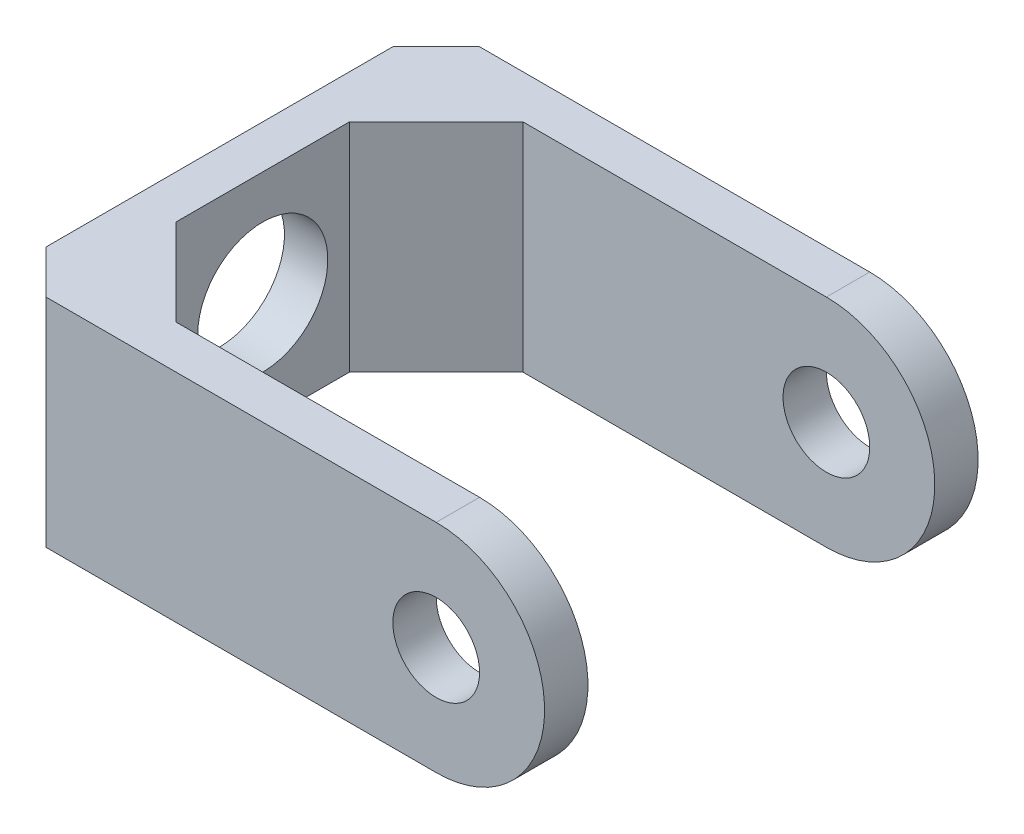
from build123d import *

# Parameters (mm, degrees)
SKETCH_1_R          = 2
EXTRUDE_1_DEPTH     = 2
SKETCH_6_W          = 20
SKETCH_6_H          = 10
EXTRUDE_5_DEPTH     = 2
CHAMFER_2_SIZE      = 2
CHAMFER_3_SIZE      = 4
SKETCH_7_R          = 3
CUT_EXTRUDE_2_DEPTH = 34.541019662


with BuildPart() as part:
    # 草图1 → 凸台-拉伸1 (new body)
    with BuildSketch(Plane.XY):
        with BuildLine():
            Line((0, 0), (18, 0))
            ThreePointArc((18, 0), (23, 5), (18, 10))
            Line((18, 10), (0, 10))
            Line((0, 10), (0, 0))
        make_face()
        with Locations((18, 5)):
            Circle(SKETCH_1_R, mode=Mode.SUBTRACT)
    extrude(amount=EXTRUDE_1_DEPTH)


with BuildPart() as body_2:
    # 镜向1: mirrored copy
    add(part.part.mirror(Plane.XY.offset(10)))


with BuildPart() as part_1:
    add(part.part)

    add(body_2.part)  # 凸台-拉伸5 merges body 2
    # 草图6 → 凸台-拉伸5 (add)
    with BuildSketch(Plane.ZY):
        with Locations((10, 5)):
            Rectangle(SKETCH_6_W, SKETCH_6_H)
    extrude(amount=EXTRUDE_5_DEPTH)

    # 倒角2
    chamfer_2_edges = [part_1.edges().sort_by_distance(p)[0] for p in [
        (-2, 5, 0),
        (-2, 5, 20),
    ]]
    chamfer(chamfer_2_edges, length=CHAMFER_2_SIZE)

    # 倒角3
    chamfer_3_edges = [part_1.edges().sort_by_distance(p)[0] for p in [
        (0, 5, 18),
        (0, 5, 2),
    ]]
    chamfer(chamfer_3_edges, length=CHAMFER_3_SIZE)

    # 草图7 → 切除-拉伸2 (cut, through all)
    with BuildSketch(Plane.ZY.offset(2)):
        with Locations((10, 5)):
            Circle(SKETCH_7_R)
    extrude(amount=-CUT_EXTRUDE_2_DEPTH, mode=Mode.SUBTRACT)


solid = part_1.part
